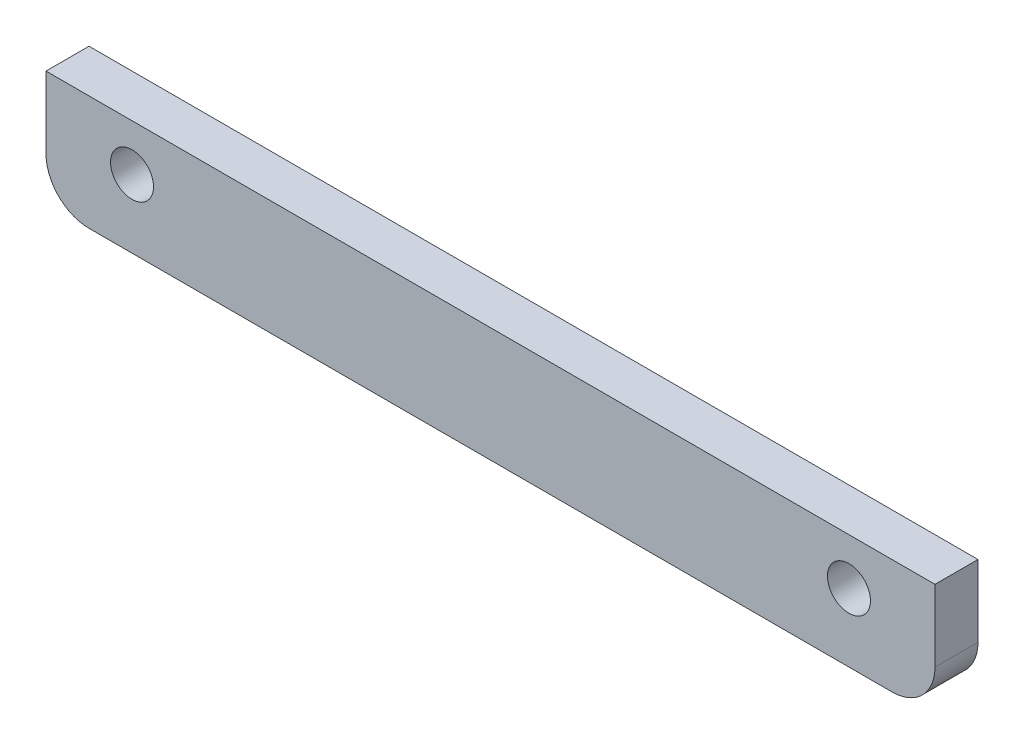
from build123d import *

# Parameters (mm, degrees)
SKETCH1_R           = 1.5
BOSS_EXTRUDE1_DEPTH = 3


with BuildPart() as part:
    # Sketch1 → Boss-Extrude1 (new body)
    with BuildSketch(Plane.XY):
        with BuildLine():
            Line((-31, 2.5), (31, 2.5))
            Line((31, 2.5), (31, -2.5))
            ThreePointArc((31, -2.5), (30.121320344, -4.621320344), (28, -5.5))
            Line((28, -5.5), (-28, -5.5))
            ThreePointArc((-28, -5.5), (-30.121320344, -4.621320344), (-31, -2.5))
            Line((-31, -2.5), (-31, 2.5))
        make_face()
        with Locations((-25, -0.75)):
            Circle(SKETCH1_R, mode=Mode.SUBTRACT)
        with Locations((25, -0.75)):
            Circle(SKETCH1_R, mode=Mode.SUBTRACT)
    extrude(amount=BOSS_EXTRUDE1_DEPTH)


solid = part.part
